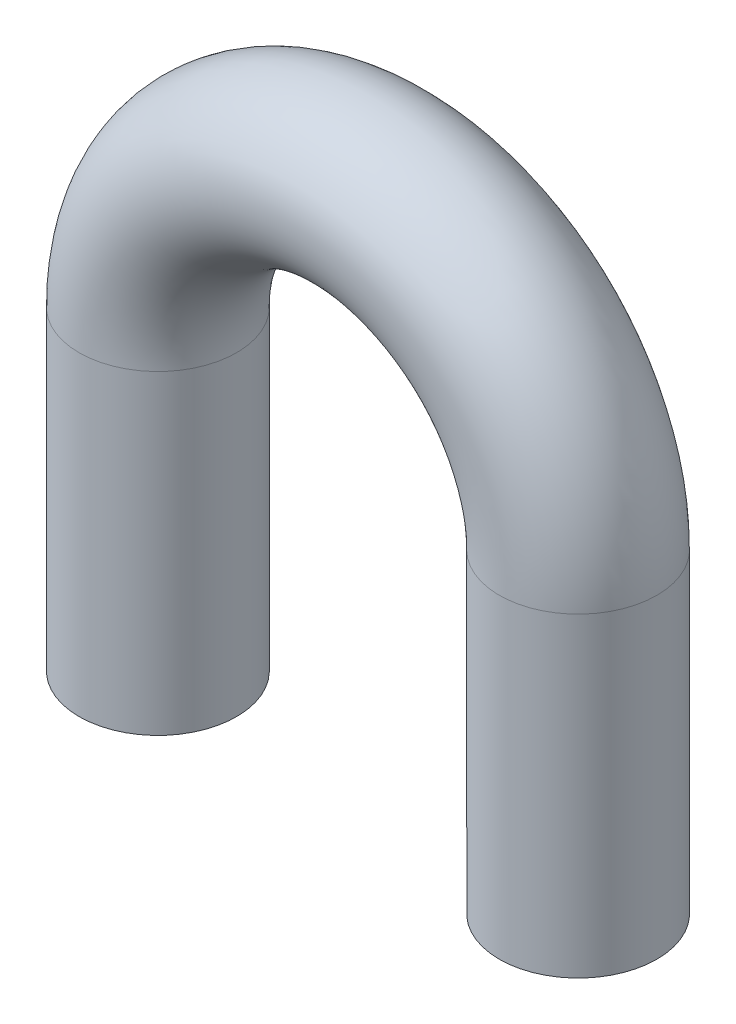
from build123d import *

# Parameters (mm, degrees)
SKETCH2_R = 7.5


with BuildPart() as part:
    # Sweep1: sweep along a path in Sketch1
    with BuildLine(Plane.XY) as sweep1_path:
        Line((-20, 0), (-20, 30))
        ThreePointArc((-20, 30), (0, 50), (20, 30))
        Line((20, 30), (20, 0))
    # Sketch2 → Sweep1 (sweep)
    with BuildSketch(Plane(origin=(0, 0, 0), x_dir=(1, 0, 0), z_dir=(0, 1, 0))):
        with Locations((-20, 0)):
            Circle(SKETCH2_R)
    sweep(path=sweep1_path.line)


solid = part.part
